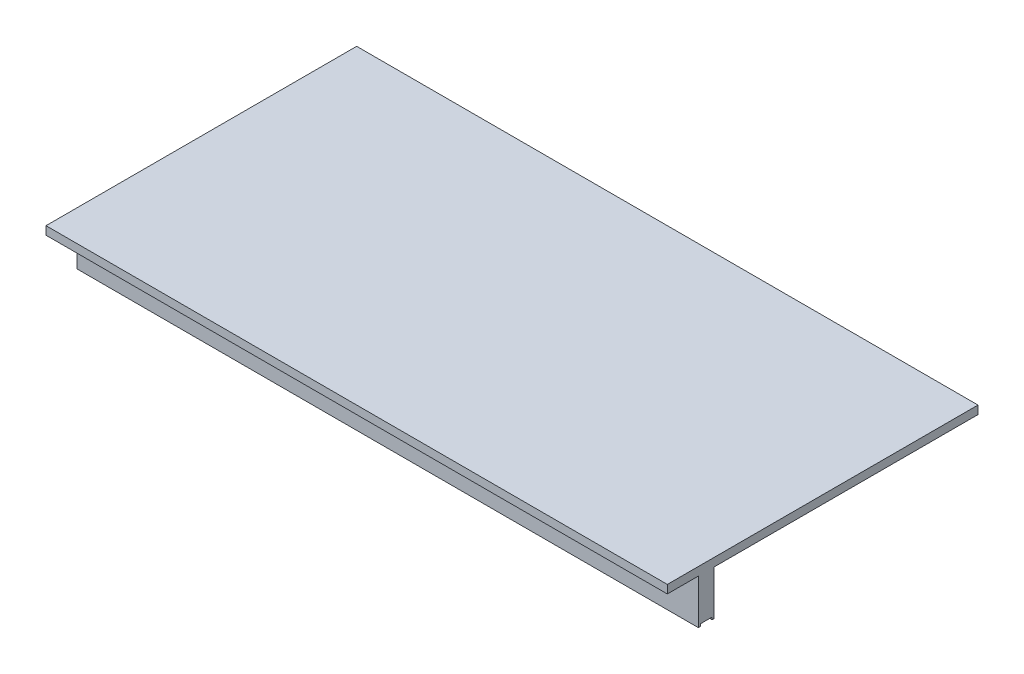
from build123d import *

# Parameters (mm, degrees)
SKETCH1_W           = 19
SKETCH1_H           = 68.229050279
BOSS_EXTRUDE1_DEPTH = 1000


with BuildPart() as part:
    # Sketch1 → Boss-Extrude1 (new body)
    with BuildSketch(Plane(origin=(0, 0, 0), x_dir=(0, 0, -1), z_dir=(1, 0, 0))):
        Polygon((0, 13.337988827), (0, 0), (50, 0), (53, 0), (72, 0), (75, 0), (500, 0), (500, 13.337988827), align=None)
        Polygon((53, 0), (50, 0), (50, -72), (53, -72), (53, -68.229050279), align=None)
        with Locations((62.5, -34.11452514)):
            Rectangle(SKETCH1_W, SKETCH1_H)
        Polygon((75, 0), (72, 0), (72, -68.229050279), (72, -72), (75, -72), align=None)
    extrude(amount=BOSS_EXTRUDE1_DEPTH)


solid = part.part
